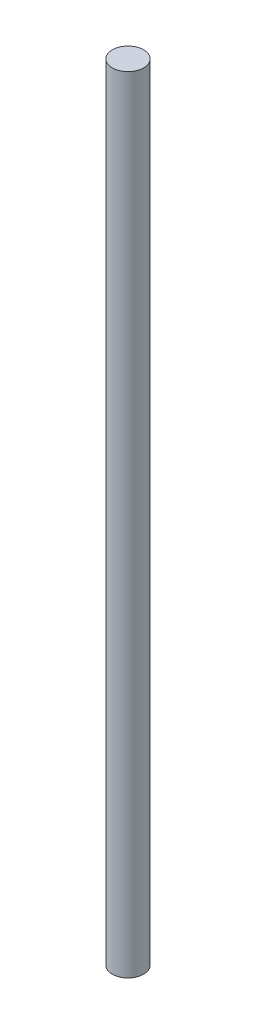
from build123d import *

# Parameters (mm, degrees)
SKETCH_1_R      = 4
EXTRUDE_1_DEPTH = 200


with BuildPart() as part:
    # 草图1 → 凸台-拉伸1 (new body)
    with BuildSketch(Plane(origin=(0, 0, 0), x_dir=(1, 0, 0), z_dir=(0, 1, 0))):
        with Locations(Location((0, 0, 0), (0, 0, 270))):
            Circle(SKETCH_1_R)
    extrude(amount=EXTRUDE_1_DEPTH)


solid = part.part
